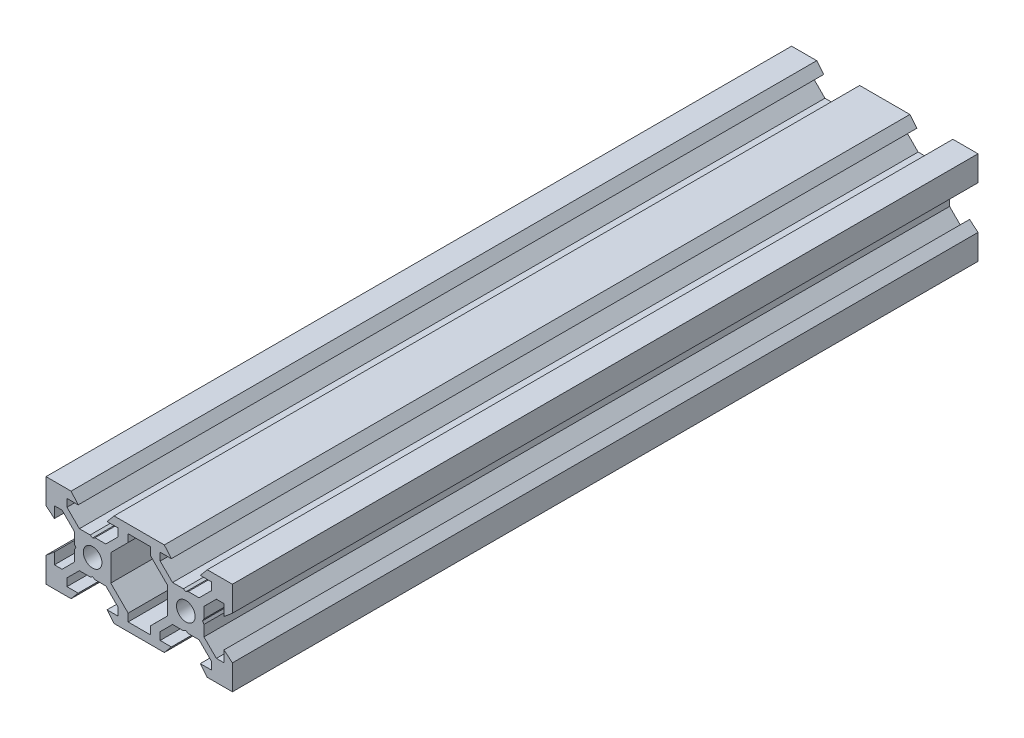
from build123d import *

# Parameters (mm, degrees)
SKETCH1_R           = 2
BOSS_EXTRUDE1_DEPTH = 160


with BuildPart() as part:
    # Sketch1 → Boss-Extrude1 (new body)
    with BuildSketch(Plane.XY):
        Polygon((-5.389620664, 10), (5.389620664, 10), (6.9, 8.2), (4.5, 8.2), (4.5, 6.556171609), (7.151917065, 3.899773171), (9.480384758, 3.899773171), (10, 3.599773171), (10.519615242, 3.899773171), (12.848082935, 3.899773171), (15.5, 6.556171609), (15.5, 8.2), (13.1, 8.2), (14.610379336, 10), (20, 10), (20, 4.610379336), (18.2, 3.1), (18.2, 5.5), (16.556171609, 5.5), (13.9, 2.839339828), (13.9, 0.519615231), (13.599999981, 0), (13.9, -0.519615231), (13.9, -2.839339828), (16.556171609, -5.5), (18.2, -5.5), (18.2, -3.1), (20, -4.610379336), (20, -10), (14.610379336, -10), (13.1, -8.2), (15.5, -8.2), (15.5, -6.556171609), (12.839339828, -3.9), (10.519222362, -3.9), (10, -3.600226829), (9.480777638, -3.9), (7.160660172, -3.9), (4.5, -6.556171609), (4.5, -8.2), (6.9, -8.2), (5.389620664, -10), (-5.389620664, -10), (-6.9, -8.2), (-4.5, -8.2), (-4.5, -6.556171609), (-7.160432959, -3.900226829), (-9.480384758, -3.900226829), (-10, -3.600226829), (-10.519615242, -3.900226829), (-12.839339828, -3.9), (-15.5, -6.556171609), (-15.5, -8.2), (-13.1, -8.2), (-14.610379336, -10), (-20, -10), (-20, -4.610379336), (-18.2, -3.1), (-18.2, -5.5), (-16.556171609, -5.5), (-13.9, -2.839339828), (-13.9, -0.519615231), (-13.599999981, 0), (-13.9, 0.519615231), (-13.9, 2.839339828), (-16.556171609, 5.5), (-18.2, 5.5), (-18.2, 3.1), (-20, 4.610379336), (-20, 10), (-14.610379336, 10), (-13.1, 8.2), (-15.5, 8.2), (-15.5, 6.556171609), (-12.839339828, 3.9), (-10.519615242, 3.899773171), (-10, 3.599773171), (-9.480384758, 3.899773171), (-7.160660172, 3.9), (-4.5, 6.556171609), (-4.5, 8.2), (-6.9, 8.2), align=None)
        with Locations((-10, 0)):
            Circle(SKETCH1_R, mode=Mode.SUBTRACT)
        with Locations((10, 0)):
            Circle(SKETCH1_R, mode=Mode.SUBTRACT)
        Polygon((-6.1, -2.839339828), (-2.376887287, -6.556171609), (-2.376887287, -8.2), (2.376887287, -8.2), (2.376887287, -6.556171609), (6.1, -2.839339828), (6.1, 2.839339828), (2.383168219, 6.556171609), (2.383168219, 8.2), (-2.383168219, 8.2), (-2.383168219, 6.556171609), (-6.1, 2.839339828), align=None, mode=Mode.SUBTRACT)
    extrude(amount=BOSS_EXTRUDE1_DEPTH)


solid = part.part
